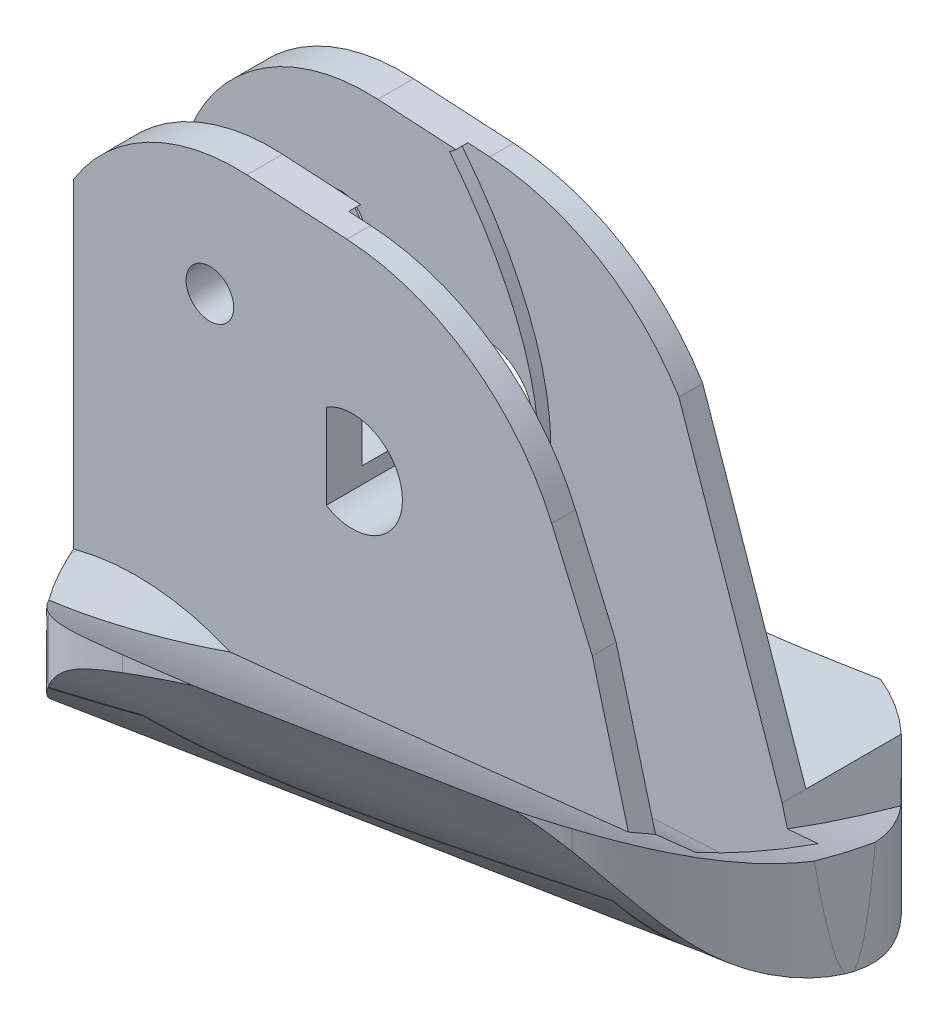
from build123d import *

# Parameters (mm, degrees)
SKETCH10_R           = 1
BOSS_EXTRUDE5_DEPTH  = 7.5
CUT_EXTRUDE1_DEPTH   = 4
FILLET1_R            = 10
CUT_EXTRUDE6_START   = -11
CUT_EXTRUDE6_DEPTH   = 10
CUT_EXTRUDE7_DEPTH   = 2
BOSS_EXTRUDE11_DEPTH = 9
CUT_EXTRUDE9_DEPTH   = 9
FILLET2_R            = 8
FILLET3_R            = 10
BOSS_EXTRUDE15_DEPTH = 2
CUT_EXTRUDE10_DEPTH  = 39
BOSS_EXTRUDE16_DEPTH = 35
SKETCH36_R           = 26.434714878
CUT_EXTRUDE11_DEPTH  = 50
CUT_EXTRUDE13_DEPTH  = 2.5
FILLET5_R            = 3
CUT_EXTRUDE14_DEPTH  = 2


with BuildPart() as part:
    # Sketch10 → Boss-Extrude5 (new, symmetric)
    with BuildSketch(Plane.XY):
        Polygon((29.817696335, 47.635346734), (33.959433176, 37.989988632), (36.993816658, 26.682834617), (12.788755024, 23.658848526), (10.279677841, 36.875809012), (12.321190148, 48.651294168), align=None)
        with Locations((17.890076876, 43.12952492)):
            Circle(SKETCH10_R, mode=Mode.SUBTRACT)
        with BuildLine():
            Line((22.782298789, 39.668364252), (22.782298789, 41.457218634))
            ThreePointArc((22.782298789, 41.457218634), (25.982298789, 39.668364252), (22.782298789, 37.87950987))
            Line((22.782298789, 37.87950987), (22.782298789, 39.668364252))
        make_face(mode=Mode.SUBTRACT)
    extrude(amount=BOSS_EXTRUDE5_DEPTH, both=True)

    # Sketch11 → Cut-Extrude1 (cut)
    with BuildSketch(Plane.XY.offset(7.5)):
        with BuildLine():
            Line((17.825431655, 32.423947427), (9.123672409, 30.207945799))
            Line((9.123672409, 30.207945799), (6.594316119, 53.15991455))
            Line((6.594316119, 53.15991455), (34.693470887, 60.271659822))
            Line((34.693470887, 60.271659822), (37.752907488, 30.846026516))
            add(Edge.make_bspline(
                [(37.752907488, 30.846026516), (30.679137573, 30.15507536), (19.269012528, 26.734198276), (17.825431655, 32.423947427)],
                knots=[0, 0, 0, 0, 1, 1, 1, 1], degree=3))
        make_face()
    extrude(amount=-CUT_EXTRUDE1_DEPTH, mode=Mode.SUBTRACT)

    # Fillet1
    fillet1_edges = [part.edges().sort_by_distance(p)[0] for p in [
        (29.817696335, 47.635346734, -2),
    ]]
    fillet(fillet1_edges, radius=FILLET1_R)

    # Sketch11<2> → Cut-Extrude6 (cut)
    with BuildSketch(Plane.XY.offset(7.5).offset(CUT_EXTRUDE6_START)):
        with BuildLine():
            Line((17.825431655, 32.423947427), (9.123672409, 30.207945799))
            Line((9.123672409, 30.207945799), (6.594316119, 53.15991455))
            Line((6.594316119, 53.15991455), (34.693470887, 60.271659822))
            Line((34.693470887, 60.271659822), (37.752907488, 30.846026516))
            add(Edge.make_bspline(
                [(37.752907488, 30.846026516), (30.679137573, 30.15507536), (19.269012528, 26.734198276), (17.825431655, 32.423947427)],
                knots=[0, 0, 0, 0, 1, 1, 1, 1], degree=3))
        make_face()
    extrude(amount=-CUT_EXTRUDE6_DEPTH, mode=Mode.SUBTRACT)

    # Sketch16 → Cut-Extrude7 (cut, symmetric)
    with BuildSketch(Plane.XY):
        Polygon((10.074284509, 54.36084815), (34.418624568, 54.36084815), (34.418624568, 36.664364271), (10.074284509, 40.645108775), align=None)
    extrude(amount=CUT_EXTRUDE7_DEPTH, both=True, mode=Mode.SUBTRACT)

    # Sketch26 → Boss-Extrude11 (add)
    with BuildSketch(Plane(origin=(41.188168375, 11.053240949, 0), x_dir=(0, 0, -1), z_dir=(0.9658266565657433, 0.2591888683316433, 0))):
        Polygon((2, 27.88983665), (2, 26.535626274), (-2, 26.535626274), (-2, 27.88983665), (-3.5, 27.88983665), (-3.5, 20.267140373), (-7.5, 20.267140373), (-7.5, 16.182607471), (7.5, 16.182607471), (7.5, 20.267140372), (3.5, 20.267140373), (3.5, 27.88983665), align=None)
    extrude(amount=BOSS_EXTRUDE11_DEPTH)

    # Sketch32 → Cut-Extrude9 (cut)
    with BuildSketch(Plane(origin=(49.880608284, 13.385940764, 0), x_dir=(0, 0, -1), z_dir=(0.9658266565657431, 0.25918886833164445, 0))):
        Polygon((3.5, 27.88983665), (2, 27.88983665), (2, 26.535626274), (-2, 26.535626274), (-2, 27.88983665), (-3.5, 27.88983665), (-3.5, 20.267140373), (-7.5, 20.267140373), (-7.5, 16.182607471), (7.5, 16.182607471), (7.5, 20.267140372), (3.5, 20.267140373), align=None)
    extrude(amount=-CUT_EXTRUDE9_DEPTH, mode=Mode.SUBTRACT)

    # Fillet2
    fillet2_edges = [part.edges().sort_by_distance(p)[0] for p in [
        (12.321190148, 48.651294168, 2.75),
        (12.321190148, 48.651294168, -2.75),
    ]]
    fillet(fillet2_edges, radius=FILLET2_R)

    # Fillet3
    fillet3_edges = [part.edges().sort_by_distance(p)[0] for p in [
        (17.825431655, 32.423947427, 5.5),
        (17.825431655, 32.423947427, -5.5),
    ]]
    fillet(fillet3_edges, radius=FILLET3_R)

    # Sketch33 → Boss-Extrude15 (add)
    with BuildSketch(Plane(origin=(0, 0, -7.5), x_dir=(-1, 0, 0), z_dir=(0, 0, -1))):
        with BuildLine():
            Line((-12.788755024, 23.658848526), (-11.433807645, 30.796247922))
            Line((-11.433807645, 30.796247922), (-12.326402939, 31.023557432))
            ThreePointArc((-12.326402939, 31.023557432), (-16.080274062, 31.249816591), (-19.652266177, 30.073545384))
            add(Edge.make_bspline(
                [(-19.652266177, 30.073545384), (-23.0941469, 28.16057184), (-30.349790115, 29.85862745), (-35.935151197, 30.627785373)],
                knots=[0.191602456, 0.191602456, 0.191602456, 0.191602456, 0.918085752, 0.918085752, 0.918085752, 0.918085752], degree=3))
            Line((-35.935151197, 30.627785373), (-36.993816658, 26.682834617))
            Line((-36.993816658, 26.682834617), (-12.788755024, 23.658848526))
        make_face()
    extrude(amount=BOSS_EXTRUDE15_DEPTH)

    # Sketch34 → Cut-Extrude10 (cut)
    with BuildSketch(Plane(origin=(38.461517044, 25.591062299, -2.646327476), x_dir=(0.15829413041500603, 0.00456516911323452, 0.9873814498496135), z_dir=(-0.9869710867739799, -0.028464036595566348, 0.15835994598658892))):
        with BuildLine():
            Line((-9.961265233, -0.738719639), (-10.539825219, -8.529669092))
            Line((-10.539825219, -8.529669092), (14.067052248, -4.634194365))
            Line((14.067052248, -4.634194365), (11.468841042, 6.956926756))
            Line((11.468841042, 6.956926756), (11.21027487, 7.304843188))
            Line((11.21027487, 7.304843188), (9.361931657, 9.097934771))
            add(Edge.make_bspline(
                [(9.361931657, 9.097934771), (8.080840594, 7.128731816), (6.182155155, 3.432947915), (1.212613563, 0.239722973), (-4.023408317, -1.262739339), (-7.989625603, -1.414236949), (-9.961265233, -0.738719639)],
                knots=[0, 0, 0, 0, 0.305306887, 0.51080958, 0.734727302, 1, 1, 1, 1], degree=3))
        make_face()
    extrude(amount=CUT_EXTRUDE10_DEPTH, mode=Mode.SUBTRACT)

    # Sketch35 → Boss-Extrude16 (add)
    with BuildSketch(Plane(origin=(38.461517044, 25.591062299, -2.646327476), x_dir=(0.15829413041500603, 0.00456516911323452, 0.9873814498496135), z_dir=(-0.9869710867739799, -0.028464036595566348, 0.15835994598658892))):
        with BuildLine():
            add(Edge.make_bspline(
                [(9.4004877, 9.184756896), (8.014929786, 7.018966969), (5.842518043, 2.878503648), (-1.139034542, -0.886617024), (-6.30542047, -1.596698786), (-9.578716562, -0.883058447)],
                knots=[0, 0, 0, 0, 0.341444372, 0.573297577, 1, 1, 1, 1], degree=3))
            add(Edge.make_bspline(
                [(9.4004877, 9.184756896), (3.32787198, 5.072103669), (-2.734752997, 1.774886575), (-13.141424705, 3.401162616), (-9.578716562, -0.883058447)],
                knots=[0, 0, 0, 0, 0, 1, 1, 1, 1, 1], degree=4))
        make_face()
    extrude(amount=BOSS_EXTRUDE16_DEPTH)

    # Sketch36 → Cut-Extrude11 (cut)
    with BuildSketch(Plane(origin=(0, 0, 0), x_dir=(1, 0, 0), z_dir=(0, 1, 0))):
        with Locations((26.225783332, -0.650291413)):
            Circle(SKETCH36_R)
        with BuildLine():
            Line((22.27470203, 9.70201848), (19.28016014, 8.542138611))
            add(Edge.make_bspline(
                [(19.28016014, 8.542138611), (18.175901997, 8.02209785), (17.104853981, 7.409710687), (15.075188036, 6.045530397), (14.110142212, 5.294388477), (13.198308873, 4.467057161)],
                knots=[0, 0, 0, 0, 0.5, 0.5, 1, 1, 1, 1], degree=3))
            add(Edge.make_bspline(
                [(13.198308873, 4.467057161), (12.856317377, 4.156758927), (12.521128574, 3.838013044), (12.062916373, 3.318460234), (11.91815484, 3.137535842), (11.661713857, 2.757043697), (11.550456081, 2.556507418), (11.455714424, 2.346031665)],
                knots=[0, 0, 0, 0, 0.5, 0.5, 0.75, 0.75, 1, 1, 1, 1], degree=3))
            add(Edge.make_bspline(
                [(11.455714424, 2.346031665), (11.284040059, 1.964644086), (11.16485619, 1.564947495), (11.008111608, 0.755442821), (10.971218182, 0.345401712), (10.98789158, -0.059156156)],
                knots=[0, 0, 0, 0, 0.5, 0.5, 1, 1, 1, 1], degree=3))
            add(Edge.make_bspline(
                [(10.98789158, -0.059156156), (10.99792158, -0.302520769), (11.02944628, -0.542488699), (11.12634683, -1.008711257), (11.19087416, -1.236563096), (11.410302161, -1.904902376), (11.588163497, -2.329957216), (11.780123254, -2.738257431)],
                knots=[0, 0, 0, 0, 0.25, 0.25, 0.5, 0.5, 1, 1, 1, 1], degree=3))
            add(Edge.make_bspline(
                [(11.780123254, -2.738257431), (11.91357793, -3.022116788), (12.05386597, -3.297269562), (12.195728557, -3.566331475)],
                knots=[0, 0, 0, 0, 1, 1, 1, 1], degree=3))
            add(Edge.make_bspline(
                [(12.195728557, -3.566331475), (12.411463271, -3.975502043), (12.630500313, -4.36877313), (13.077923556, -5.124332793), (13.305396924, -5.484478562), (13.784469569, -6.164821799), (14.038623175, -6.484734929), (14.587070822, -7.070943503), (14.880298966, -7.339084541), (15.189604703, -7.586330457)],
                knots=[0, 0, 0, 0, 0.25, 0.25, 0.5, 0.5, 0.75, 0.75, 1, 1, 1, 1], degree=3))
            add(Edge.make_bspline(
                [(15.189604703, -7.586330457), (15.484527228, -7.822079042), (15.790917234, -8.036380128), (16.451082548, -8.411819372), (16.805158657, -8.572703094), (17.60008374, -8.824782036), (18.030120375, -8.910944932), (18.925051233, -9.040134767), (19.385267736, -9.083946683), (19.847770317, -9.121583058)],
                knots=[0, 0, 0, 0, 0.25, 0.25, 0.5, 0.5, 0.75, 0.75, 1, 1, 1, 1], degree=3))
            add(Edge.make_bspline(
                [(19.847770317, -9.121583058), (20.375853971, -9.164556125), (20.90568312, -9.20026391), (21.963401198, -9.264462665), (22.492291454, -9.291642406), (24.079899428, -9.35758558), (25.138685282, -9.380681557), (26.225783332, -9.357302516)],
                knots=[0, 0, 0, 0, 0.25, 0.25, 0.5, 0.5, 1, 1, 1, 1], degree=3))
            ThreePointArc((26.225783332, -9.357302516), (29.135522917, -8.98002407), (32.045328198, -8.603252657))
            add(Edge.make_bspline(
                [(32.045328198, -8.603252657), (32.484857242, -8.475440114), (32.895008957, -8.331386668), (33.660733722, -8.009704849), (34.00893391, -7.836068963), (34.332027275, -7.648103897)],
                knots=[0, 0, 0, 0, 0.5, 0.5, 1, 1, 1, 1], degree=3))
            add(Edge.make_bspline(
                [(34.332027275, -7.648103897), (34.986829665, -7.267161457), (35.515098099, -6.839968082), (35.962895786, -6.347700951)],
                knots=[0, 0, 0, 0, 1, 1, 1, 1], degree=3))
            add(Edge.make_bspline(
                [(35.962895786, -6.347700951), (36.217673321, -6.067622223), (36.444572042, -5.771472761), (36.864366191, -5.144270772), (37.056224896, -4.813190072), (37.409085181, -4.11242964), (37.57010651, -3.7427783), (37.862184847, -2.960448803), (37.993551386, -2.545662841), (38.217781289, -1.687850228), (38.311536987, -1.243194379), (38.457020018, -0.320960637), (38.508907408, 0.156589114), (38.545365074, 0.899478523), (38.550501782, 1.152558758), (38.544056398, 1.661018247), (38.532558536, 1.91672128), (38.469145021, 2.687450512), (38.389101774, 3.20619335), (38.18502652, 3.987182111), (38.102568828, 4.247637925), (37.909070913, 4.753539957), (37.797769203, 5.000809197), (37.547107967, 5.484130164), (37.407750734, 5.720183397), (37.101959894, 6.181256328), (36.93469576, 6.407104102), (36.405911762, 7.054359847), (36.015122249, 7.450571298), (35.171278077, 8.185026799), (34.717166803, 8.523302018), (33.777912102, 9.130316752), (33.289845505, 9.402055779), (32.528307149, 9.758845099), (32.268400105, 9.8695554), (31.742955676, 10.068933287), (31.477765165, 10.157278993), (30.674717675, 10.388182685), (30.129373581, 10.496569888), (29.020328896, 10.630345177), (28.45541172, 10.655622251), (27.892174079, 10.647517977)],
                knots=[0, 0, 0, 0, 0.0625, 0.0625, 0.125, 0.125, 0.1875, 0.1875, 0.25, 0.25, 0.3125, 0.3125, 0.375, 0.375, 0.40625, 0.40625, 0.4375, 0.4375, 0.5, 0.5, 0.53125, 0.53125, 0.5625, 0.5625, 0.59375, 0.59375, 0.625, 0.625, 0.6875, 0.6875, 0.75, 0.75, 0.8125, 0.8125, 0.84375, 0.84375, 0.875, 0.875, 0.9375, 0.9375, 1, 1, 1, 1], degree=3))
            add(Edge.make_bspline(
                [(27.892174079, 10.647517977), (26.933414273, 10.633722642), (25.988610902, 10.528875138), (24.584544995, 10.286198743), (24.118853872, 10.190148513), (23.1920584, 9.96824464), (22.729958594, 9.842020448), (22.27470203, 9.70201848)],
                knots=[0, 0, 0, 0, 0.5, 0.5, 0.75, 0.75, 1, 1, 1, 1], degree=3))
        make_face(mode=Mode.SUBTRACT)
    extrude(amount=CUT_EXTRUDE11_DEPTH, mode=Mode.SUBTRACT)

    # Sketch38 → Cut-Extrude13 (cut, symmetric)
    with BuildSketch(Plane.XY):
        with BuildLine():
            Line((25.630505815, 35.197420962), (28.423953414, 17.491969512))
            Line((28.423953414, 17.491969512), (38.658608962, 12.202078844))
            Line((38.658608962, 12.202078844), (36.141575896, 49.028287034))
            Line((36.141575896, 49.028287034), (23.973363778, 49.028287034))
            Line((23.973363778, 49.028287034), (22.465197824, 47.841248074))
            add(Edge.make_bspline(
                [(22.465197824, 47.841248074), (27.708259845, 41.179792215), (25.630505815, 35.197420962)],
                knots=[0, 0, 0, 1, 1, 1], degree=2))
        make_face()
    extrude(amount=CUT_EXTRUDE13_DEPTH, both=True, mode=Mode.SUBTRACT)

    # Fillet5
    fillet5_edges = [part.edges().sort_by_distance(p)[0] for p in [
        (32.51380906, 25.144124896, -2.5),
    ]]
    fillet(fillet5_edges, radius=FILLET5_R)

    # Sketch39 → Cut-Extrude14 (cut)
    with BuildSketch(Plane(origin=(0, 0, -3.5), x_dir=(-1, 0, 0), z_dir=(0, 0, -1))):
        Polygon((-31.149589966, 44.533606687), (-35.935151197, 30.627785373), (-33.959433176, 37.989988632), align=None)
    extrude(amount=-CUT_EXTRUDE14_DEPTH, mode=Mode.SUBTRACT)


solid = part.part
